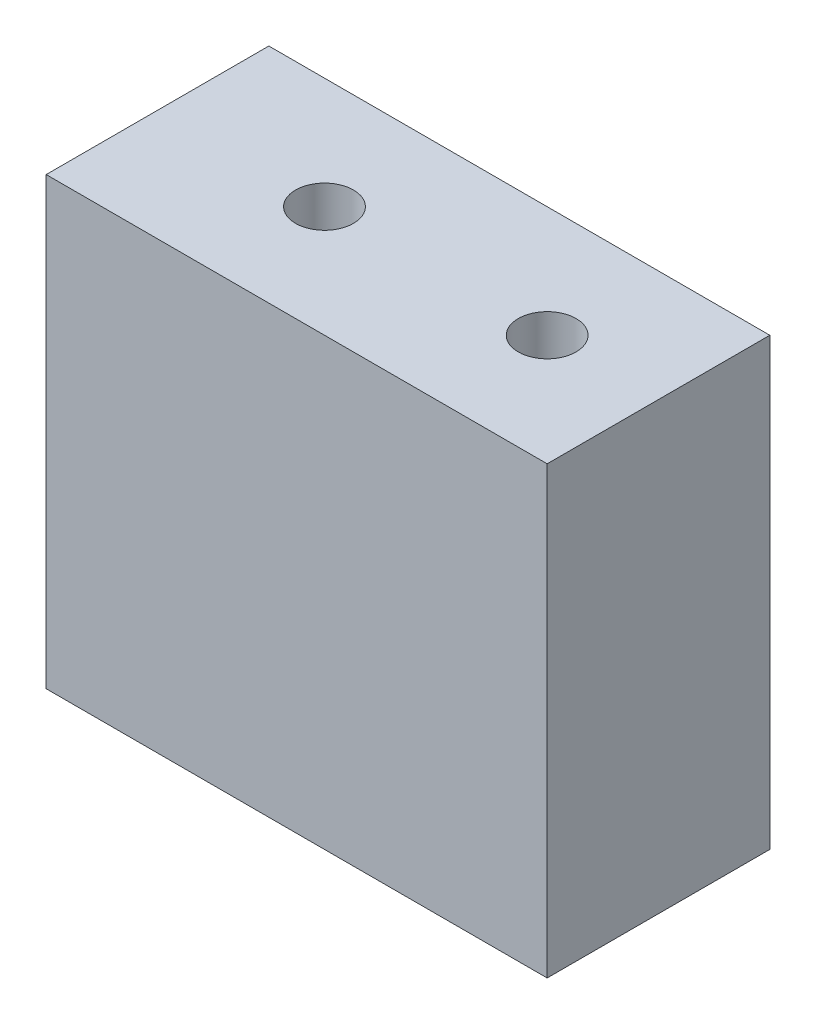
from build123d import *

# Parameters (mm, degrees)
CROQUIS2_W              = 57.15
CROQUIS2_H              = 50.8
SALIENTE_EXTRUIR1_DEPTH = 25.4
CROQUIS3_R              = 3.302
CORTAR_EXTRUIR1_DEPTH   = 64.579325453


with BuildPart() as part:
    # Croquis2 → Saliente-Extruir1 (new body)
    with BuildSketch(Plane.XY):
        Rectangle(CROQUIS2_W, CROQUIS2_H)
    extrude(amount=SALIENTE_EXTRUIR1_DEPTH)

    # Croquis3 → Cortar-Extruir1 (cut, through all)
    with BuildSketch(Plane(origin=(0, 25.4, 0), x_dir=(1, 0, 0), z_dir=(0, 1, 0))):
        with Locations((-9.525, -12.7)):
            Circle(CROQUIS3_R)
        with Locations((15.875, -12.7)):
            Circle(CROQUIS3_R)
    extrude(amount=-CORTAR_EXTRUIR1_DEPTH, mode=Mode.SUBTRACT)


solid = part.part
